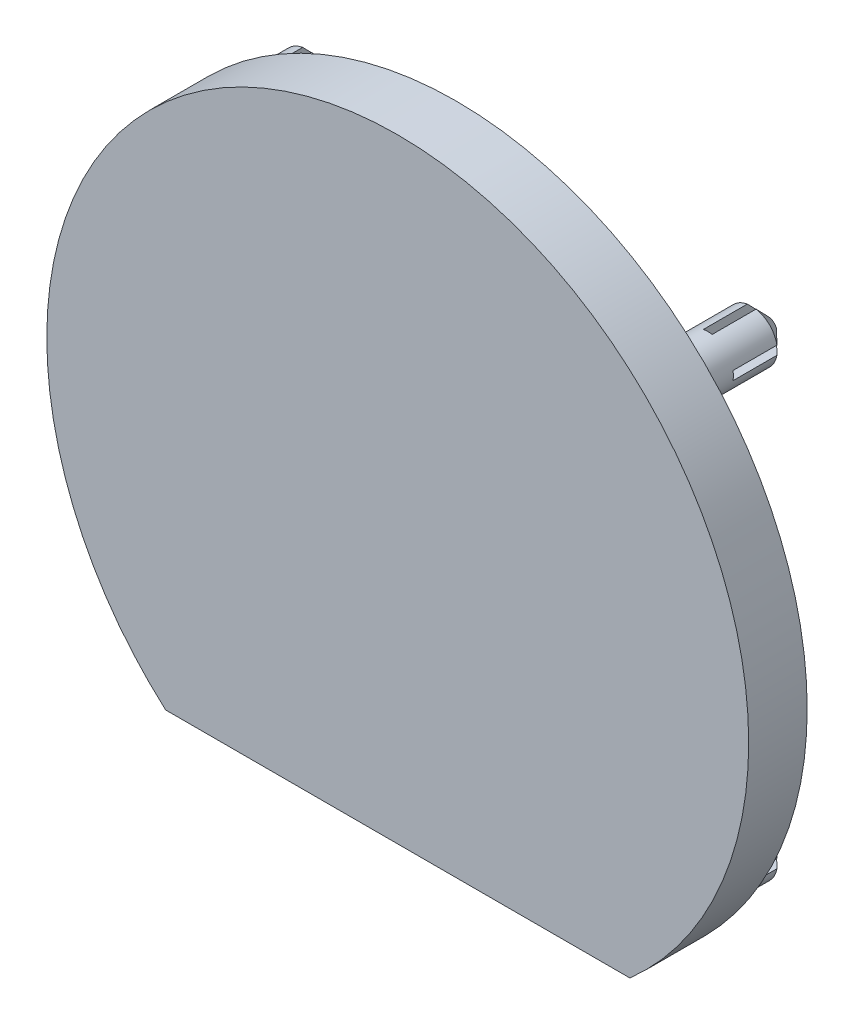
from build123d import *

# Parameters (mm, degrees)
BOSS_EXTRUDE1_DEPTH   = 4
SKETCH3_R             = 1.75
BOSS_EXTRUDE2_DEPTH   = 6
BOSS_EXTRUDE2_2_DEPTH = 6
BOSS_EXTRUDE2_3_DEPTH = 6
BOSS_EXTRUDE2_4_DEPTH = 6
CHAMFER1_SIZE         = 1
CHAMFER2_SIZE         = 1
CHAMFER3_SIZE         = 1
CHAMFER4_SIZE         = 1
SKETCH4_W             = 0.6
SKETCH4_H             = 0.6
SKETCH4_W_2           = 1.7
SKETCH4_H_2           = 1.7
CUT_EXTRUDE1_DEPTH    = 4


with BuildPart() as part:
    # Sketch1 → Boss-Extrude1 (new body)
    with BuildSketch(Plane.XY):
        with BuildLine():
            Line((15.874507866, -18), (-15.874507866, -18))
            ThreePointArc((-15.874507866, -18), (0, 24), (15.874507866, -18))
        make_face()
    extrude(amount=BOSS_EXTRUDE1_DEPTH)


with BuildPart() as body_2:
    # Sketch3 → Boss-Extrude2 (new body)
    with BuildSketch(Plane(origin=(0, 0, 0), x_dir=(-1, 0, 0), z_dir=(0, 0, -1))):
        with Locations((-15.202795796, -15.202795796)):
            Circle(SKETCH3_R)
    extrude(amount=BOSS_EXTRUDE2_DEPTH)

    # Chamfer2
    chamfer2_edges = [body_2.edges().sort_by_distance(p)[0] for p in [
        (16.952795796, -15.202795796, -6),
    ]]
    chamfer(chamfer2_edges, length=CHAMFER2_SIZE)


with BuildPart() as body_3:
    # Sketch3 → Boss-Extrude2 2 (new body)
    with BuildSketch(Plane(origin=(0, 0, 0), x_dir=(-1, 0, 0), z_dir=(0, 0, -1))):
        with Locations((15.202795796, -15.202795796)):
            Circle(SKETCH3_R)
    extrude(amount=BOSS_EXTRUDE2_2_DEPTH)

    # Chamfer4
    chamfer4_edges = [body_3.edges().sort_by_distance(p)[0] for p in [
        (-13.452795796, -15.202795796, -6),
    ]]
    chamfer(chamfer4_edges, length=CHAMFER4_SIZE)


with BuildPart() as body_4:
    # Sketch3 → Boss-Extrude2 3 (new body)
    with BuildSketch(Plane(origin=(0, 0, 0), x_dir=(-1, 0, 0), z_dir=(0, 0, -1))):
        with Locations((15.202795796, 15.202795796)):
            Circle(SKETCH3_R)
    extrude(amount=BOSS_EXTRUDE2_3_DEPTH)

    # Chamfer3
    chamfer3_edges = [body_4.edges().sort_by_distance(p)[0] for p in [
        (-13.452795796, 15.202795796, -6),
    ]]
    chamfer(chamfer3_edges, length=CHAMFER3_SIZE)


with BuildPart() as body_5:
    # Sketch3 → Boss-Extrude2 4 (new body)
    with BuildSketch(Plane(origin=(0, 0, 0), x_dir=(-1, 0, 0), z_dir=(0, 0, -1))):
        with Locations((-15.202795796, 15.202795796)):
            Circle(SKETCH3_R)
    extrude(amount=BOSS_EXTRUDE2_4_DEPTH)

    # Chamfer1
    chamfer1_edges = [body_5.edges().sort_by_distance(p)[0] for p in [
        (16.952795796, 15.202795796, -6),
    ]]
    chamfer(chamfer1_edges, length=CHAMFER1_SIZE)


with BuildPart() as cut_extrude1_tool:
    # Sketch4 → Cut-Extrude1 (new body)
    with BuildSketch(Plane(origin=(0, 0, -6), x_dir=(-1, 0, 0), z_dir=(0, 0, -1))):
        with Locations((15.202795796, -15.202795796)):
            Rectangle(SKETCH4_W, SKETCH4_H)
        with Locations((16.352795796, -15.202795796)):
            Rectangle(SKETCH4_W_2, SKETCH4_H)
        with Locations((14.052795796, -15.202795796)):
            Rectangle(SKETCH4_W_2, SKETCH4_H)
        with Locations((15.202795796, -14.052795796)):
            Rectangle(SKETCH4_W, SKETCH4_H_2)
        with Locations((15.202795796, -16.352795796)):
            Rectangle(SKETCH4_W, SKETCH4_H_2)
        with Locations((-15.202795796, -15.202795796)):
            Rectangle(SKETCH4_W, SKETCH4_H)
        with BuildLine():
            Line((-14.515409441, -14.902795796), (-14.902795796, -14.902795796))
            Line((-14.902795796, -14.902795796), (-14.902795796, -15.502795796))
            Line((-14.902795796, -15.502795796), (-14.515409441, -15.502795796))
            ThreePointArc((-14.515409441, -15.502795796), (-14.468616061, -15.356028028), (-14.452795796, -15.202795796))
            ThreePointArc((-14.452795796, -15.202795796), (-14.468616061, -15.049563563), (-14.515409441, -14.902795796))
        make_face()
        with BuildLine():
            Line((-13.202795796, -14.902795796), (-14.515409441, -14.902795796))
            ThreePointArc((-14.515409441, -14.902795796), (-14.468616061, -15.049563563), (-14.452795796, -15.202795796))
            ThreePointArc((-14.452795796, -15.202795796), (-14.468616061, -15.356028028), (-14.515409441, -15.502795796))
            Line((-14.515409441, -15.502795796), (-13.202795796, -15.502795796))
            Line((-13.202795796, -15.502795796), (-13.202795796, -14.902795796))
        make_face()
        with BuildLine():
            Line((-14.902795796, -15.502795796), (-15.502795796, -15.502795796))
            Line((-15.502795796, -15.502795796), (-15.502795796, -15.89018215))
            ThreePointArc((-15.502795796, -15.89018215), (-15.202795796, -15.952795796), (-14.902795796, -15.89018215))
            Line((-14.902795796, -15.89018215), (-14.902795796, -15.502795796))
        make_face()
        with BuildLine():
            ThreePointArc((-14.902795796, -15.89018215), (-15.202795796, -15.952795796), (-15.502795796, -15.89018215))
            Line((-15.502795796, -15.89018215), (-15.502795796, -17.202795796))
            Line((-15.502795796, -17.202795796), (-14.902795796, -17.202795796))
            Line((-14.902795796, -17.202795796), (-14.902795796, -15.89018215))
        make_face()
        with BuildLine():
            Line((-15.502795796, -15.502795796), (-15.502795796, -14.902795796))
            Line((-15.502795796, -14.902795796), (-15.89018215, -14.902795796))
            ThreePointArc((-15.89018215, -14.902795796), (-15.952795796, -15.202795796), (-15.89018215, -15.502795796))
            Line((-15.89018215, -15.502795796), (-15.502795796, -15.502795796))
        make_face()
        with BuildLine():
            ThreePointArc((-15.89018215, -15.502795796), (-15.952795796, -15.202795796), (-15.89018215, -14.902795796))
            Line((-15.89018215, -14.902795796), (-17.202795796, -14.902795796))
            Line((-17.202795796, -14.902795796), (-17.202795796, -15.502795796))
            Line((-17.202795796, -15.502795796), (-15.89018215, -15.502795796))
        make_face()
        with BuildLine():
            ThreePointArc((-14.902795796, -14.515409441), (-15.202795796, -14.452795796), (-15.502795796, -14.515409441))
            Line((-15.502795796, -14.515409441), (-15.502795796, -14.902795796))
            Line((-15.502795796, -14.902795796), (-14.902795796, -14.902795796))
            Line((-14.902795796, -14.902795796), (-14.902795796, -14.515409441))
        make_face()
        with BuildLine():
            Line((-14.902795796, -13.202795796), (-15.502795796, -13.202795796))
            Line((-15.502795796, -13.202795796), (-15.502795796, -14.515409441))
            ThreePointArc((-15.502795796, -14.515409441), (-15.202795796, -14.452795796), (-14.902795796, -14.515409441))
            Line((-14.902795796, -14.515409441), (-14.902795796, -13.202795796))
        make_face()
        with Locations((15.202795796, 15.202795796)):
            Rectangle(SKETCH4_W, SKETCH4_H)
        with Locations((16.352795796, 15.202795796)):
            Rectangle(SKETCH4_W_2, SKETCH4_H)
        with Locations((15.202795796, 16.352795796)):
            Rectangle(SKETCH4_W, SKETCH4_H_2)
        with Locations((14.052795796, 15.202795796)):
            Rectangle(SKETCH4_W_2, SKETCH4_H)
        with Locations((15.202795796, 14.052795796)):
            Rectangle(SKETCH4_W, SKETCH4_H_2)
        with Locations((-15.202795796, 15.202795796)):
            Rectangle(SKETCH4_W, SKETCH4_H)
        with Locations((-14.052795796, 15.202795796)):
            Rectangle(SKETCH4_W_2, SKETCH4_H)
        with Locations((-15.202795796, 16.352795796)):
            Rectangle(SKETCH4_W, SKETCH4_H_2)
        with Locations((-16.352795796, 15.202795796)):
            Rectangle(SKETCH4_W_2, SKETCH4_H)
        with Locations((-15.202795796, 14.052795796)):
            Rectangle(SKETCH4_W, SKETCH4_H_2)
    extrude(amount=-CUT_EXTRUDE1_DEPTH)


with BuildPart() as body_2_1:
    add(body_2.part)

    # Cut-Extrude1: cut by cut_extrude1_tool
    add(cut_extrude1_tool.part, mode=Mode.SUBTRACT)


with BuildPart() as body_3_1:
    add(body_3.part)

    # Cut-Extrude1: cut by cut_extrude1_tool
    add(cut_extrude1_tool.part, mode=Mode.SUBTRACT)


with BuildPart() as body_4_1:
    add(body_4.part)

    # Cut-Extrude1: cut by cut_extrude1_tool
    add(cut_extrude1_tool.part, mode=Mode.SUBTRACT)


with BuildPart() as body_5_1:
    add(body_5.part)

    # Cut-Extrude1: cut by cut_extrude1_tool
    add(cut_extrude1_tool.part, mode=Mode.SUBTRACT)


solid = Compound([part.part, body_2_1.part, body_3_1.part, body_4_1.part, body_5_1.part])
